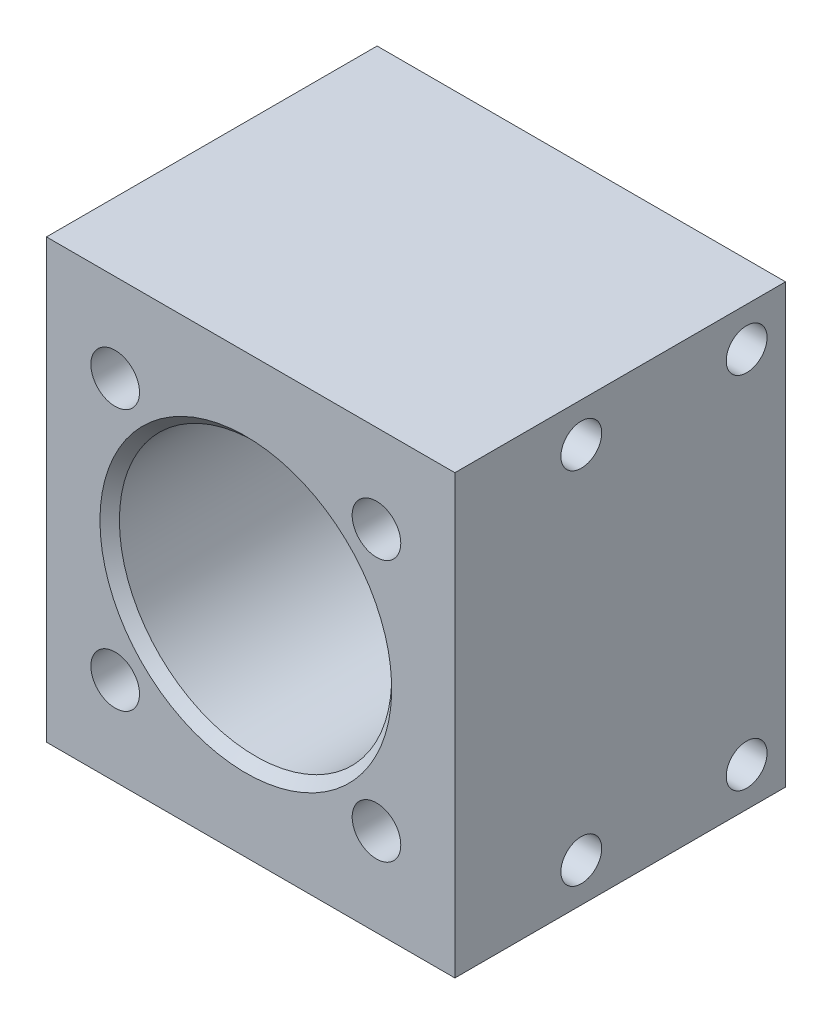
from build123d import *

# Parameters (mm, degrees)
SZKIC1_W                       = 42
SZKIC1_H                       = 45
SZKIC1_R                       = 14
DODANIE_WYCI_GNI_CIE1_DEPTH    = 34
SFAZOWANIE1_SIZE               = 1
OTW_R_GWINTOWANY_M6X1_01_D     = 5
OTW_R_GWINTOWANY_M6X1_01_DEPTH = 17
OTW_R_GWINTOWANY_M6X1_01_TIP   = 1.502151548
OTW_R_GWINTOWANY_M5X0_82_D     = 4.2
OTW_R_GWINTOWANY_M5X0_82_DEPTH = 25
OTW_R_GWINTOWANY_M5X0_82_TIP   = 1.2618073


with BuildPart() as part:
    # Szkic1 → Dodanie-wyciągnięcie1 (new body)
    with BuildSketch(Plane.XY):
        with Locations((21, 22.5)):
            Rectangle(SZKIC1_W, SZKIC1_H)
        with Locations((20.5, 22.5)):
            Circle(SZKIC1_R, mode=Mode.SUBTRACT)
    extrude(amount=DODANIE_WYCI_GNI_CIE1_DEPTH)

    # Sfazowanie1
    sfazowanie1_edges = [part.edges().sort_by_distance(p)[0] for p in [
        (6.5, 22.5, 0),
        (6.5, 22.5, 34),
    ]]
    chamfer(sfazowanie1_edges, length=SFAZOWANIE1_SIZE)

    # Otwór gwintowany M6x1.01
    with Locations(Plane.XY.offset(34)):
        with Locations((33.935028843, 35.935028843), (7.064971157, 35.935028843), (7.064971157, 9.064971157), (33.935028843, 9.064971157)):
            Hole(OTW_R_GWINTOWANY_M6X1_01_D / 2, depth=OTW_R_GWINTOWANY_M6X1_01_DEPTH)
            with Locations((0, 0, -(OTW_R_GWINTOWANY_M6X1_01_DEPTH + OTW_R_GWINTOWANY_M6X1_01_TIP / 2))):  # 118° drill point
                Cone(0, OTW_R_GWINTOWANY_M6X1_01_D / 2, OTW_R_GWINTOWANY_M6X1_01_TIP, mode=Mode.SUBTRACT)

    # Otwór gwintowany M5x0.82
    with Locations(Plane(origin=(42, 0, 0), x_dir=(0, 0, -1), z_dir=(1, 0, 0))):
        with Locations((-21, 41), (-4, 41), (-4, 4), (-21, 4)):
            Hole(OTW_R_GWINTOWANY_M5X0_82_D / 2, depth=OTW_R_GWINTOWANY_M5X0_82_DEPTH)
            with Locations((0, 0, -(OTW_R_GWINTOWANY_M5X0_82_DEPTH + OTW_R_GWINTOWANY_M5X0_82_TIP / 2))):  # 118° drill point
                Cone(0, OTW_R_GWINTOWANY_M5X0_82_D / 2, OTW_R_GWINTOWANY_M5X0_82_TIP, mode=Mode.SUBTRACT)


solid = part.part
